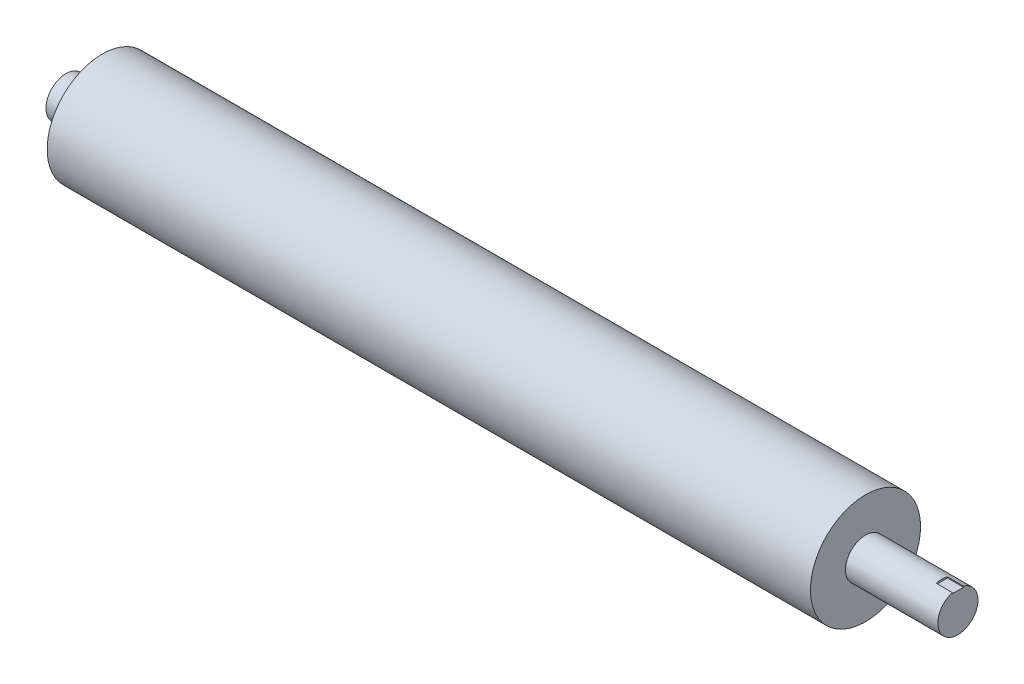
from build123d import *

# Parameters (mm, degrees)
SKETCH2_W          = 28
SKETCH2_H          = 5.2
CUT_EXTRUDE1_DEPTH = 40


with BuildPart() as part:
    # Sketch1 → Revolve1 (revolve)
    with BuildSketch(Plane(origin=(0, 0, 0), x_dir=(1, 0, 0), z_dir=(0, 1, 0))):
        Polygon((0, 0), (-1040, 0), (-1040, 50), (-950, 50), (-950, 137), (0, 137), (950, 137), (950, 50), (1180, 50), (1180, 0), align=None)
    revolve(axis=Axis((0, 0, 0), (-1, 0, 0)))

    # Sketch2 → Cut-Extrude1 (cut)
    with BuildSketch(Plane(origin=(1180, 0, 0), x_dir=(0, 0, -1), z_dir=(1, 0, 0))):
        with Locations((0, 48)):
            Rectangle(SKETCH2_W, SKETCH2_H)
    extrude(amount=-CUT_EXTRUDE1_DEPTH, mode=Mode.SUBTRACT)


solid = part.part
